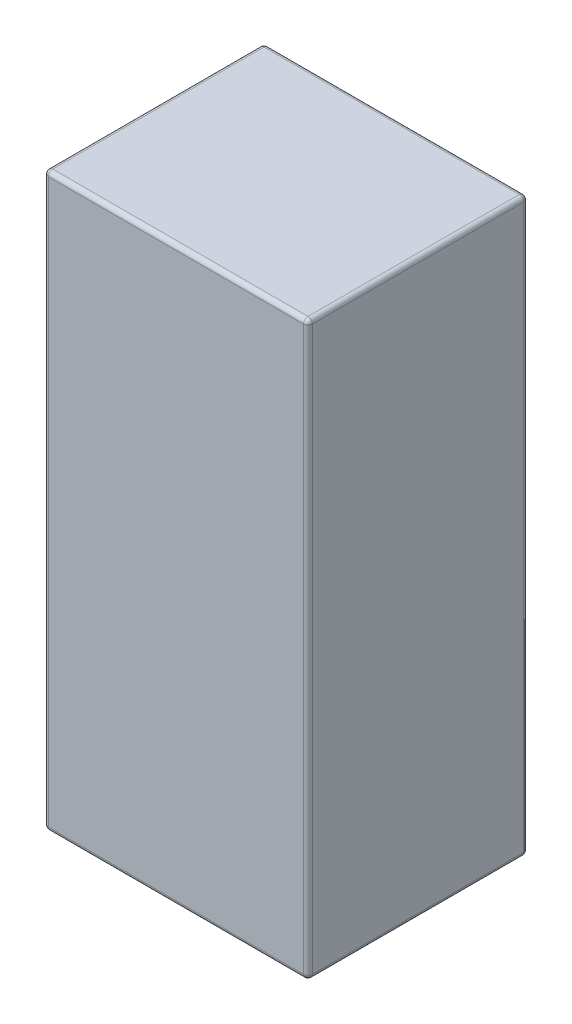
from build123d import *

# Parameters (mm, degrees)
SKETCH1_W           = 13
SKETCH1_H           = 6
BOSS_EXTRUDE1_DEPTH = 5
FILLET1_R           = 0.1


with BuildPart() as part:
    # Sketch1 → Boss-Extrude1 (new body)
    with BuildSketch(Plane(origin=(0, 0, 0), x_dir=(0, 1, 0), z_dir=(0, 0, 1))):
        Rectangle(SKETCH1_W, SKETCH1_H)
    extrude(amount=BOSS_EXTRUDE1_DEPTH)

    # Fillet1
    fillet1_edges = [part.edges().sort_by_distance(p)[0] for p in [
        (0, -6.5, 5),
        (3, 0, 5),
        (0, 6.5, 5),
        (3, 0, 0),
        (0, -6.5, 0),
        (-3, 0, 0),
        (0, 6.5, 0),
        (3, 6.5, 2.5),
        (3, -6.5, 2.5),
        (-3, -6.5, 2.5),
        (-3, 6.5, 2.5),
        (-3, 0, 5),
    ]]
    fillet(fillet1_edges, radius=FILLET1_R)


solid = part.part
